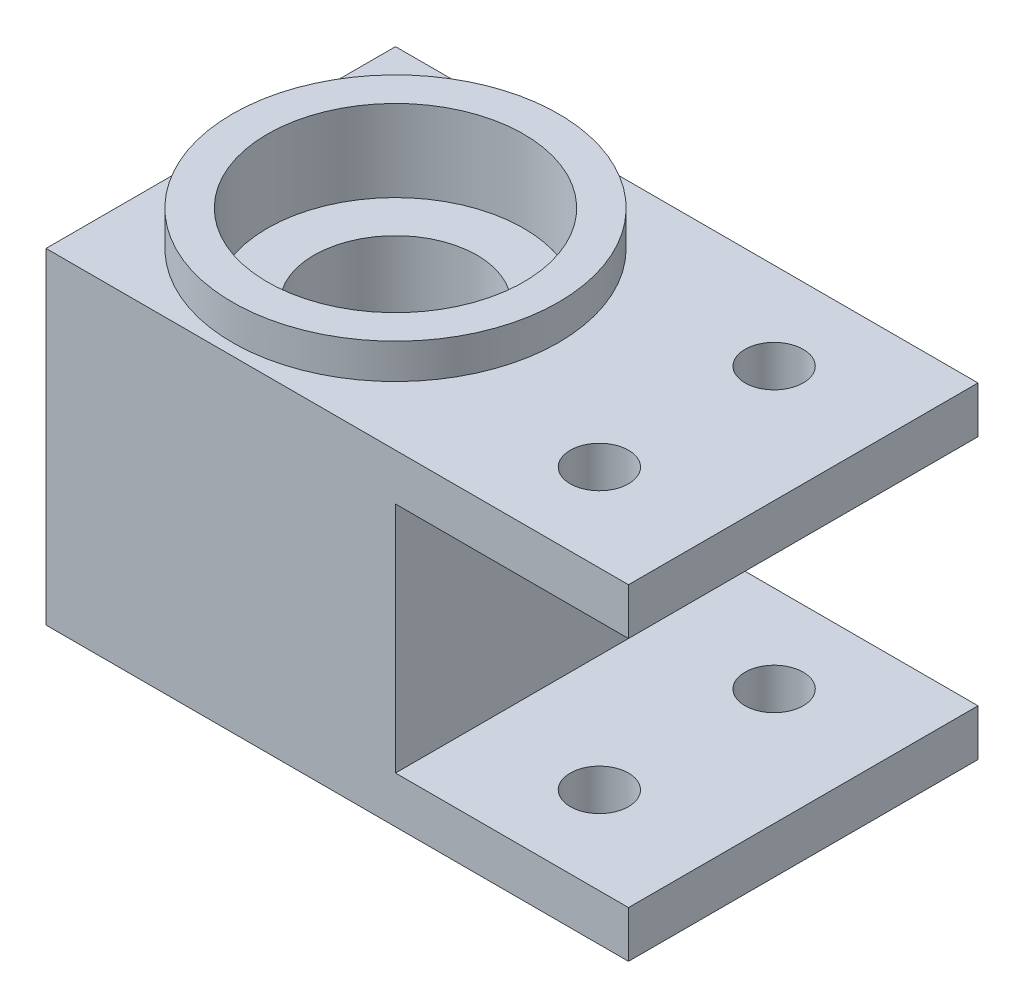
from build123d import *

# Parameters (mm, degrees)
BOSS_EXTRUDE1_DEPTH = 30
SKETCH2_R           = 7
CUT_EXTRUDE1_DEPTH  = 58.306195128
SKETCH3_R           = 11
CUT_EXTRUDE2_DEPTH  = 4
CUT_EXTRUDE3_START  = -7
SKETCH4_R           = 11
CUT_EXTRUDE3_DEPTH  = 7
SKETCH5_R           = 2.5
CUT_EXTRUDE4_DEPTH  = 58.306195128
BOSS_EXTRUDE2_START = 3
SKETCH6_R           = 14
SKETCH6_R_2         = 11
BOSS_EXTRUDE2_DEPTH = 3


with BuildPart() as part:
    # Sketch1 → Boss-Extrude1 (new body)
    with BuildSketch(Plane.XY):
        Polygon((10, 10), (10, 14), (-40, 14), (-40, -14), (10, -14), (10, -10), (-10, -10), (-10, 10), align=None)
    extrude(amount=BOSS_EXTRUDE1_DEPTH)

    # Sketch2 → Cut-Extrude1 (cut, through all)
    with BuildSketch(Plane(origin=(0, 14, 0), x_dir=(1, 0, 0), z_dir=(0, 1, 0))):
        with Locations(Location((-25, -15, 0), (0, 0, 270))):
            Circle(SKETCH2_R)
    extrude(amount=-CUT_EXTRUDE1_DEPTH, mode=Mode.SUBTRACT)

    # Sketch3 → Cut-Extrude2 (cut)
    with BuildSketch(Plane(origin=(0, 14, 0), x_dir=(1, 0, 0), z_dir=(0, 1, 0))):
        with Locations(Location((-25, -15, 0), (0, 0, 180))):
            Circle(SKETCH3_R)
    extrude(amount=-CUT_EXTRUDE2_DEPTH, mode=Mode.SUBTRACT)

    # Sketch4 → Cut-Extrude3 (cut)
    with BuildSketch(Plane.XZ.offset(14).offset(CUT_EXTRUDE3_START)):
        with Locations(Location((-25, 15, 0), (0, 0, 180))):
            Circle(SKETCH4_R)
    extrude(amount=CUT_EXTRUDE3_DEPTH, mode=Mode.SUBTRACT)

    # Sketch5 → Cut-Extrude4 (cut, through all)
    with BuildSketch(Plane(origin=(0, 14, 0), x_dir=(1, 0, 0), z_dir=(0, 1, 0))):
        with Locations(Location((0, -22.5, 0), (0, 0, 180))):
            Circle(SKETCH5_R)
        with Locations(Location((0, -7.5, 0), (0, 0, 180))):
            Circle(SKETCH5_R)
    extrude(amount=-CUT_EXTRUDE4_DEPTH, mode=Mode.SUBTRACT)

    # Sketch6 → Boss-Extrude2 (add)
    with BuildSketch(Plane(origin=(0, 14, 0), x_dir=(1, 0, 0), z_dir=(0, 1, 0)).offset(BOSS_EXTRUDE2_START)):
        with Locations((-25, -15)):
            Circle(SKETCH6_R)
        with Locations(Location((-25, -15, 0), (0, 0, 180))):
            Circle(SKETCH6_R_2, mode=Mode.SUBTRACT)
    extrude(amount=-BOSS_EXTRUDE2_DEPTH)


solid = part.part
